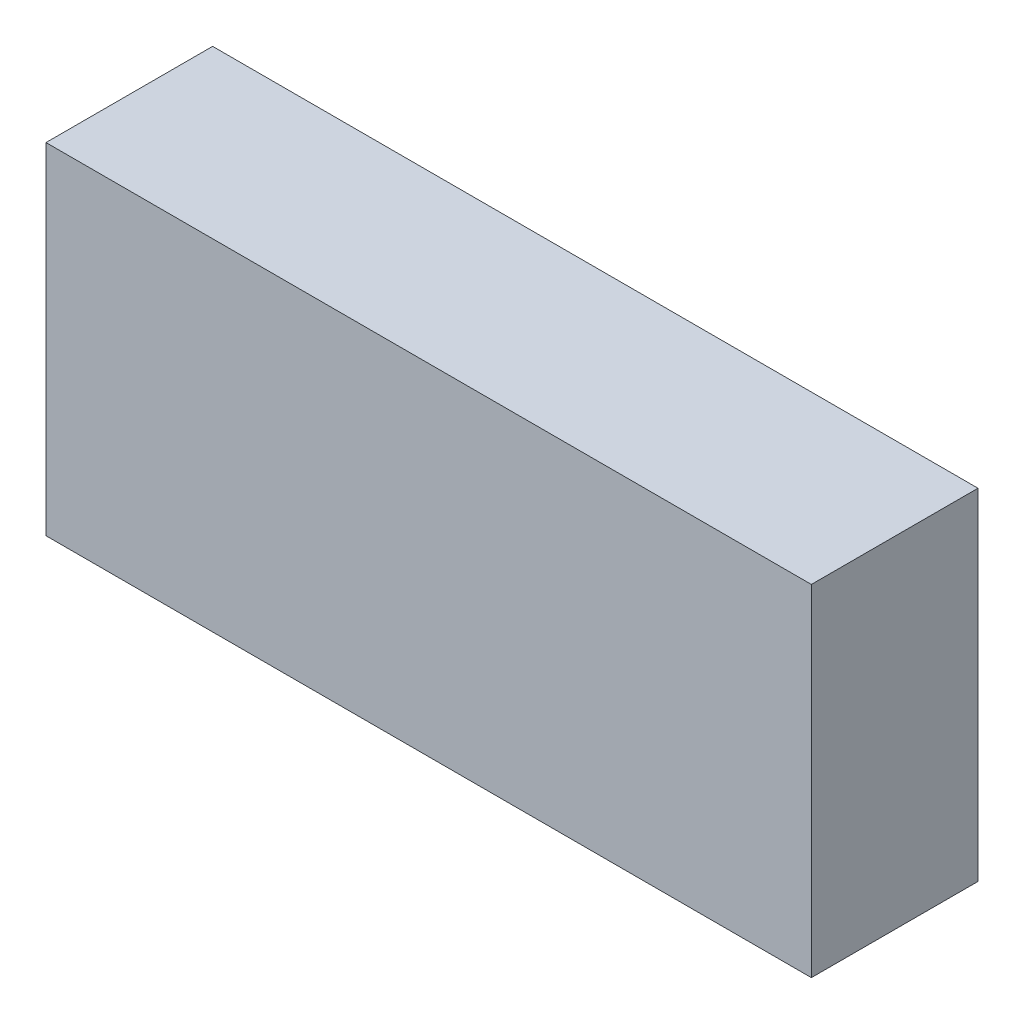
from build123d import *

# Parameters (mm, degrees)
ESQUISSE1_W        = 45.93192881
ESQUISSE1_H        = 20.437135922
BOSS_EXTRU_1_DEPTH = 10


with BuildPart() as part:
    # Esquisse1 → Boss.-Extru.1 (new body)
    with BuildSketch(Plane.XY):
        with Locations((22.965964405, -10.218567961)):
            Rectangle(ESQUISSE1_W, ESQUISSE1_H)
    extrude(amount=BOSS_EXTRU_1_DEPTH)


solid = part.part
